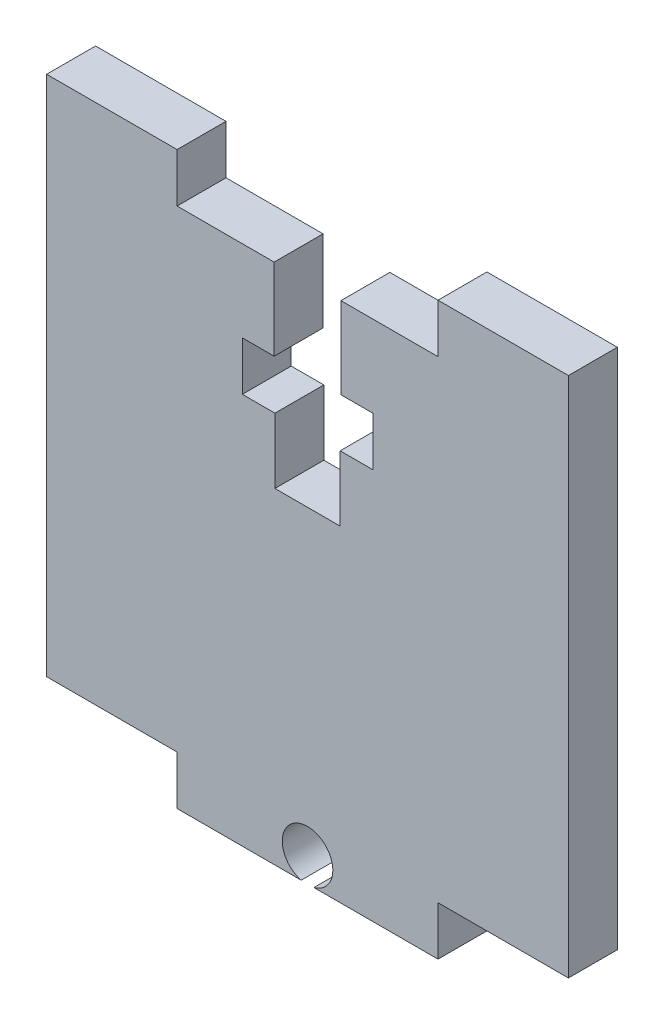
from build123d import *

# Parameters (mm, degrees)
EXTRUDE_1_DEPTH = 3


with BuildPart() as part:
    # 草图2 → 凸台-拉伸1 (new body)
    with BuildSketch(Plane.XY):
        with BuildLine():
            Line((2.047890023, 48.855305477), (8, 48.855305477))
            Line((8, 48.855305477), (8, 51.855305477))
            Line((8, 51.855305477), (16, 51.855305477))
            Line((16, 51.855305477), (16, 19.855305477))
            Line((16, 19.855305477), (8, 19.855305477))
            Line((8, 19.855305477), (8, 16.855305477))
            Line((8, 16.855305477), (0.390512484, 16.855305477))
            ThreePointArc((0.390512484, 16.855305477), (0, 19.905305477), (-0.390512484, 16.855305477))
            Line((-0.390512484, 16.855305477), (-8, 16.855305477))
            Line((-8, 16.855305477), (-8, 19.855305477))
            Line((-8, 19.855305477), (-16, 19.855305477))
            Line((-16, 19.855305477), (-16, 51.855305477))
            Line((-16, 51.855305477), (-8, 51.855305477))
            Line((-8, 51.855305477), (-8, 48.855305477))
            Line((-8, 48.855305477), (-2.047890023, 48.855305477))
            Line((-2.047890023, 48.855305477), (-2.047890023, 43.855305477))
            Line((-2.047890023, 43.855305477), (-4, 43.855305477))
            Line((-4, 43.855305477), (-4, 40.855305477))
            Line((-4, 40.855305477), (-2, 40.855305477))
            Line((-2, 40.855305477), (-2, 36.855305477))
            Line((-2, 36.855305477), (2, 36.855305477))
            Line((2, 36.855305477), (2, 40.855305477))
            Line((2, 40.855305477), (4, 40.855305477))
            Line((4, 40.855305477), (4, 43.855305477))
            Line((4, 43.855305477), (2.047890023, 43.855305477))
            Line((2.047890023, 43.855305477), (2.047890023, 48.855305477))
        make_face()
    extrude(amount=EXTRUDE_1_DEPTH)


solid = part.part
